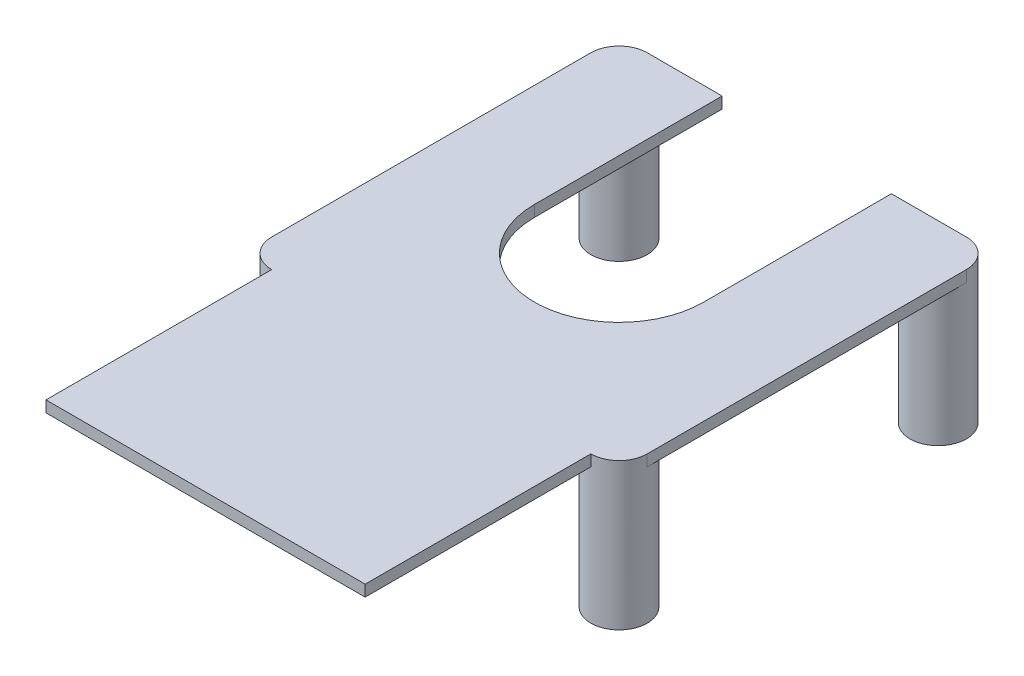
from build123d import *
from build123d.topology import SkipClean

# Parameters (mm, degrees)
SKETCH1_R             = 5
BOSS_EXTRUDE1_DEPTH   = 24
BOSS_EXTRUDE1_2_DEPTH = 24
BOSS_EXTRUDE1_3_DEPTH = 24
BOSS_EXTRUDE1_4_DEPTH = 24
BOSS_EXTRUDE3_START   = 2
BOSS_EXTRUDE3_DEPTH   = 2


with BuildPart() as part:
    # Sketch1 → Boss-Extrude1 (new body)
    with BuildSketch(Plane(origin=(0, 0, 0), x_dir=(1, 0, 0), z_dir=(0, 1, 0))):
        with Locations((-28.285, 61.57)):
            Circle(SKETCH1_R)
    extrude(amount=-BOSS_EXTRUDE1_DEPTH)



with BuildPart() as body_2:
    # Sketch1 → Boss-Extrude1 2 (new body)
    with BuildSketch(Plane(origin=(0, 0, 0), x_dir=(1, 0, 0), z_dir=(0, 1, 0))):
        with Locations((28.285, 61.57)):
            Circle(SKETCH1_R)
    extrude(amount=-BOSS_EXTRUDE1_2_DEPTH)


with BuildPart() as body_3:
    # Sketch1 → Boss-Extrude1 3 (new body)
    with BuildSketch(Plane(origin=(0, 0, 0), x_dir=(1, 0, 0), z_dir=(0, 1, 0))):
        with Locations((-28.285, 5)):
            Circle(SKETCH1_R)
    extrude(amount=-BOSS_EXTRUDE1_3_DEPTH)


with BuildPart() as body_4:
    # Sketch1 → Boss-Extrude1 4 (new body)
    with BuildSketch(Plane(origin=(0, 0, 0), x_dir=(1, 0, 0), z_dir=(0, 1, 0))):
        with Locations((28.285, 5)):
            Circle(SKETCH1_R)
    extrude(amount=-BOSS_EXTRUDE1_4_DEPTH)


with BuildPart() as part_1:
    with SkipClean():  # the faces are left unmerged after this step: merging them gives an invalid solid
        add(part.part)

        add(body_2.part)  # Boss-Extrude3 merges body 2

        add(body_3.part)  # Boss-Extrude3 merges body 3

        add(body_4.part)  # Boss-Extrude3 merges body 4
        # Sketch1<5> → Boss-Extrude3 (add)
        with BuildSketch(Plane(origin=(0, 0, 0), x_dir=(1, 0, 0), z_dir=(0, 1, 0)).offset(BOSS_EXTRUDE3_START)):
            with BuildLine():
                ThreePointArc((15, 33.285), (0, 18.285), (-15, 33.285))
                Line((-15, 33.285), (-15, 66.57))
                Line((-15, 66.57), (-28.285, 66.57))
                ThreePointArc((-28.285, 66.57), (-31.820533906, 65.105533906), (-33.285, 61.57))
                Line((-33.285, 61.57), (-33.285, 5))
                ThreePointArc((-33.285, 5), (-31.820533906, 1.464466094), (-28.285, 0))
                Line((-28.285, 0), (-28.285, -40))
                Line((-28.285, -40), (28.285, -40))
                Line((28.285, -40), (28.285, 0))
                ThreePointArc((28.285, 0), (31.820533906, 1.464466094), (33.285, 5))
                Line((33.285, 5), (33.285, 61.57))
                ThreePointArc((33.285, 61.57), (31.820533906, 65.105533906), (28.285, 66.57))
                Line((28.285, 66.57), (15, 66.57))
                Line((15, 66.57), (15, 33.285))
            make_face()
        extrude(amount=-BOSS_EXTRUDE3_DEPTH)


solid = part_1.part
